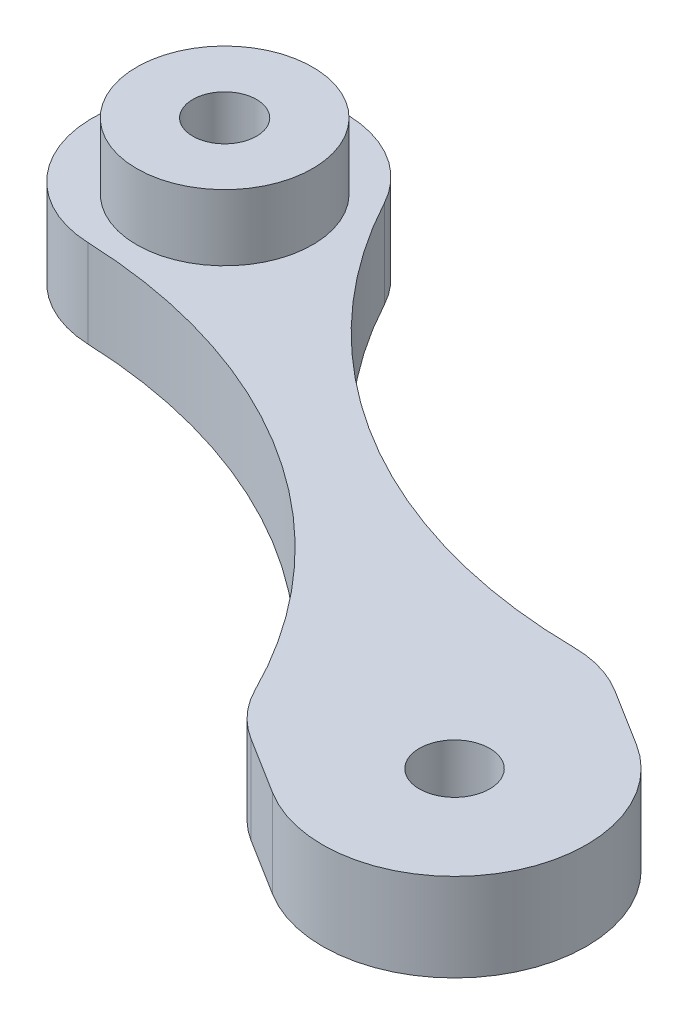
from build123d import *

# Parameters (mm, degrees)
SKETCH1_R           = 1.45
SKETCH1_R_2         = 1.6
BOSS_EXTRUDE1_DEPTH = 4
SKETCH2_R           = 4
SKETCH2_R_2         = 1.45
BOSS_EXTRUDE2_DEPTH = 3
SKETCH3_R           = 25
CUT_EXTRUDE1_DEPTH  = 10
FILLET1_R           = 5


with BuildPart() as part:
    # Sketch1 → Boss-Extrude1 (new body)
    # profile 1 of 3: a face of its own
    with BuildSketch(Plane(origin=(0, 0, 0), x_dir=(1, 0, 0), z_dir=(0, 1, 0))):
        with BuildLine():
            ThreePointArc((6, 0), (5.247620154, 2.909034672), (3.179172425, 5.088502991))
            ThreePointArc((3.179172425, 5.088502991), (-3.872509642, 4.582976007), (-5.547666284, -2.285475619))
            ThreePointArc((-5.547666284, -2.285475619), (-4.582976007, -3.872509642), (-3.179172425, -5.088502991))
            ThreePointArc((-3.179172425, -5.088502991), (2.909034672, -5.247620154), (6, 0))
        make_face()
        with Locations(Location((0, 0, 0), (0, 0, 270))):
            Circle(SKETCH1_R, mode=Mode.SUBTRACT)
    # profile 2 of 3: a face of its own
    with BuildSketch(Plane(origin=(0, 0, 0), x_dir=(1, 0, 0), z_dir=(0, 1, 0))):
        with BuildLine():
            Line((31.029172425, -12.311497009), (3.179172425, 5.088502991))
            ThreePointArc((3.179172425, 5.088502991), (5.247620154, 2.909034672), (6, 0))
            ThreePointArc((6, 0), (2.909034672, -5.247620154), (-3.179172425, -5.088502991))
            Line((-3.179172425, -5.088502991), (24.670827575, -22.488502991))
            ThreePointArc((24.670827575, -22.488502991), (22.602379846, -20.309034672), (21.85, -17.4))
            ThreePointArc((21.85, -17.4), (23.259082466, -13.536908466), (26.824492066, -11.488288448))
            ThreePointArc((26.824492066, -11.488288448), (29.002816451, -11.511790235), (31.029172425, -12.311497009))
        make_face()
    # profile 3 of 3: a face of its own
    with BuildSketch(Plane(origin=(0, 0, 0), x_dir=(1, 0, 0), z_dir=(0, 1, 0))):
        with BuildLine():
            ThreePointArc((33.85, -17.4), (33.097620154, -14.490965328), (31.029172425, -12.311497009))
            ThreePointArc((31.029172425, -12.311497009), (29.002816451, -11.511790235), (26.824492066, -11.488288448))
            ThreePointArc((26.824492066, -11.488288448), (23.259082466, -13.536908466), (21.85, -17.4))
            ThreePointArc((21.85, -17.4), (22.602379846, -20.309034672), (24.670827575, -22.488502991))
            ThreePointArc((24.670827575, -22.488502991), (30.759034672, -22.647620154), (33.85, -17.4))
        make_face()
        with Locations(Location((27.85, -17.4, 0), (0, 0, 270))):
            Circle(SKETCH1_R_2, mode=Mode.SUBTRACT)
    extrude(amount=BOSS_EXTRUDE1_DEPTH)

    # Sketch2 → Boss-Extrude2 (add)
    with BuildSketch(Plane(origin=(0, 4, 0), x_dir=(1, 0, 0), z_dir=(0, 1, 0))):
        with Locations(Location((0, 0, 0), (0, 0, 270))):
            Circle(SKETCH2_R)
        with Locations(Location((0, 0, 0), (0, 0, 270))):
            Circle(SKETCH2_R_2, mode=Mode.SUBTRACT)
    extrude(amount=BOSS_EXTRUDE2_DEPTH)

    # Sketch3 → Cut-Extrude1 (cut)
    with BuildSketch(Plane(origin=(0, 4, 0), x_dir=(1, 0, 0), z_dir=(0, 1, 0))):
        with Locations((-2.15, -30)):
            Circle(SKETCH3_R)
        with Locations((26.019288726, 15.087051209)):
            Circle(SKETCH3_R)
    extrude(amount=-CUT_EXTRUDE1_DEPTH, mode=Mode.SUBTRACT)

    # Fillet1
    fillet1_edges = [part.edges().sort_by_distance(p)[0] for p in [
        (-3.277923152, 2, 5.025457174),
        (20.790880187, 2, 20.064406598),
        (27.149225038, 2, 9.887400616),
        (3.079209508, 2, -5.149608607),
    ]]
    fillet(fillet1_edges, radius=FILLET1_R)


solid = part.part
